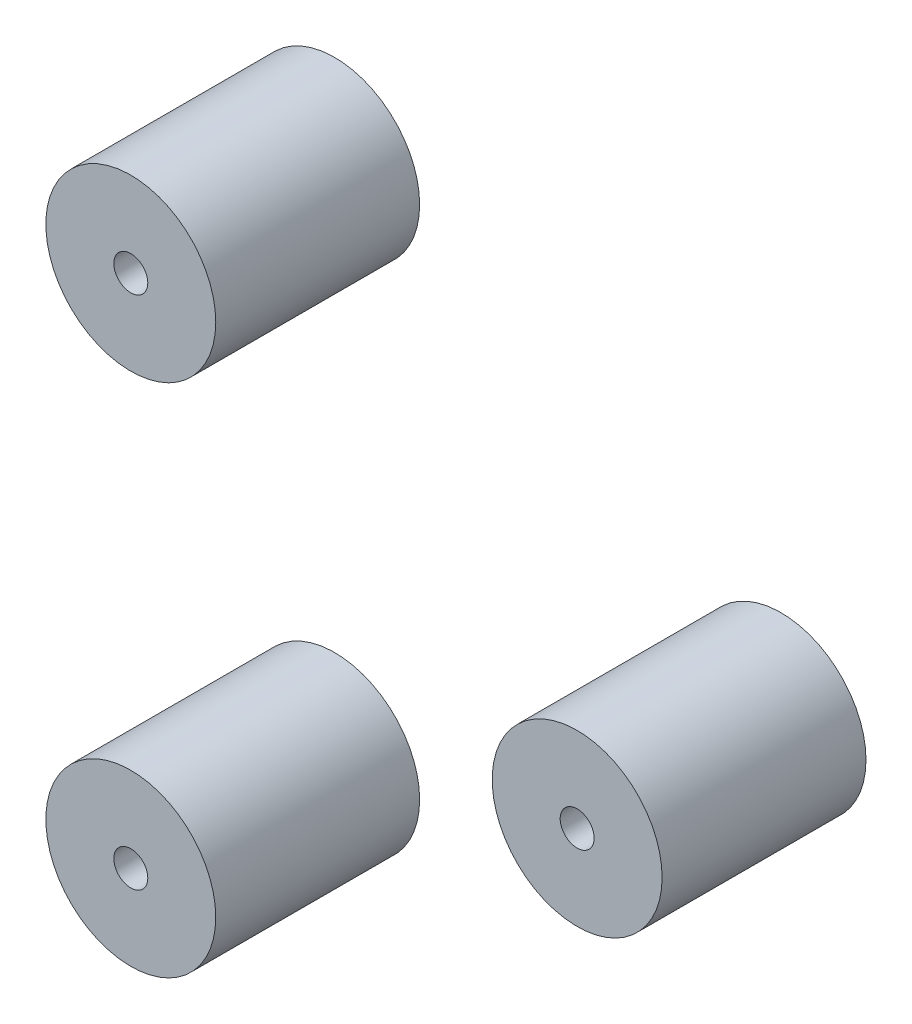
from build123d import *

# Parameters (mm, degrees)
ESQUISSE1_R             = 12.5
ESQUISSE1_R_2           = 2.5
BOSS_EXTRU_1_DEPTH      = 30
BOSS_EXTRU_1_2_DEPTH    = 30
BOSS_EXTRU_1_3_DEPTH    = 30
ESQUISSE3_R             = 8
ENL_V_MAT_EXTRU_1_DEPTH = 25


with BuildPart() as part:
    # Esquisse1 → Boss.-Extru.1 (new body)
    with BuildSketch(Plane.XY):
        with Locations((43.785036873, 0)):
            Circle(ESQUISSE1_R)
        with Locations((43.785036873, 0)):
            Circle(ESQUISSE1_R_2, mode=Mode.SUBTRACT)
    extrude(amount=BOSS_EXTRU_1_DEPTH)


with BuildPart() as body_2:
    # Esquisse1 → Boss.-Extru.1 2 (new body)
    with BuildSketch(Plane.XY):
        with Locations((-21.892518437, -37.918954238)):
            Circle(ESQUISSE1_R)
        with Locations((-21.892518437, -37.918954238)):
            Circle(ESQUISSE1_R_2, mode=Mode.SUBTRACT)
    extrude(amount=BOSS_EXTRU_1_2_DEPTH)


with BuildPart() as body_3:
    # Esquisse1 → Boss.-Extru.1 3 (new body)
    with BuildSketch(Plane.XY):
        with Locations((-21.892518437, 37.918954238)):
            Circle(ESQUISSE1_R)
        with Locations((-21.892518437, 37.918954238)):
            Circle(ESQUISSE1_R_2, mode=Mode.SUBTRACT)
    extrude(amount=BOSS_EXTRU_1_3_DEPTH)


with BuildPart() as enl_v_mat_extru_1_tool:
    # Esquisse3 → Enlèv. mat.-Extru.1 (new body)
    with BuildSketch(Plane(origin=(0, 0, 0), x_dir=(-1, 0, 0), z_dir=(0, 0, -1))):
        with Locations((21.892518437, -37.918954238)):
            Circle(ESQUISSE3_R)
        with Locations((-43.785036873, 0)):
            Circle(ESQUISSE3_R)
        with Locations((21.892518437, 37.918954238)):
            Circle(ESQUISSE3_R)
    extrude(amount=-ENL_V_MAT_EXTRU_1_DEPTH)


with BuildPart() as part_1:
    add(part.part)

    # Enlèv. mat.-Extru.1: cut by enl_v_mat_extru_1_tool
    add(enl_v_mat_extru_1_tool.part, mode=Mode.SUBTRACT)


with BuildPart() as body_2_1:
    add(body_2.part)

    # Enlèv. mat.-Extru.1: cut by enl_v_mat_extru_1_tool
    add(enl_v_mat_extru_1_tool.part, mode=Mode.SUBTRACT)


with BuildPart() as body_3_1:
    add(body_3.part)

    # Enlèv. mat.-Extru.1: cut by enl_v_mat_extru_1_tool
    add(enl_v_mat_extru_1_tool.part, mode=Mode.SUBTRACT)


solid = Compound([part_1.part, body_2_1.part, body_3_1.part])
